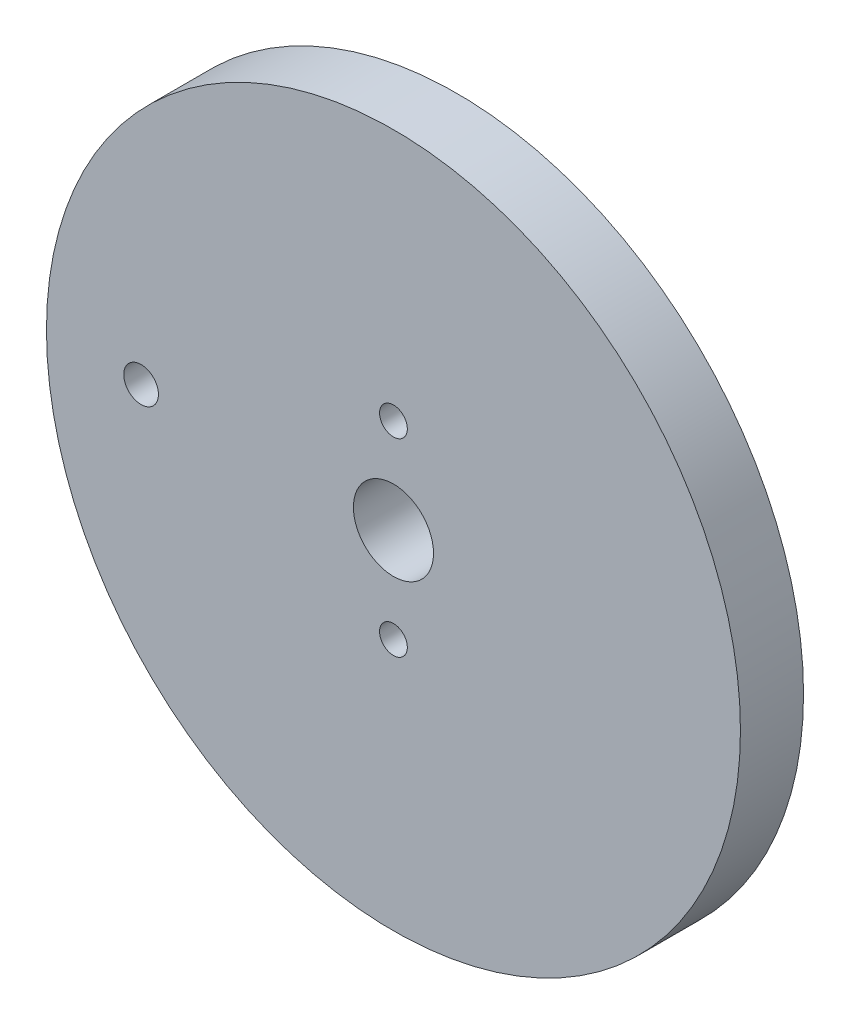
from build123d import *

# Parameters (mm, degrees)
SKETCH1_R          = 55
EXTRUDE_3_8_DEPTH  = 10
SKETCH5_R          = 6.35
CUT_EXTRUDE2_DEPTH = 10
SKETCH6_R          = 2.2
M4_THROUGH2_DEPTH  = 10
SKETCH7_R          = 2.75
CUT_EXTRUDE4_DEPTH = 10


with BuildPart() as part:
    # Sketch1 → 3/8 (new body)
    with BuildSketch(Plane.XY):
        Circle(SKETCH1_R)
    extrude(amount=EXTRUDE_3_8_DEPTH)

    # Sketch5 → Cut-Extrude2 (cut)
    with BuildSketch(Plane.XY.offset(10)):
        Circle(SKETCH5_R)
    extrude(amount=-CUT_EXTRUDE2_DEPTH, mode=Mode.SUBTRACT)

    # Sketch6 → M4_through2 (cut)
    with BuildSketch(Plane.XY.offset(10)):
        with Locations((0, 15)):
            Circle(SKETCH6_R)
        with Locations((0, -15)):
            Circle(SKETCH6_R)
    extrude(amount=-M4_THROUGH2_DEPTH, mode=Mode.SUBTRACT)

    # Sketch7 → Cut-Extrude4 (cut)
    with BuildSketch(Plane.XY.offset(10)):
        with Locations((-40, 0)):
            Circle(SKETCH7_R)
    extrude(amount=-CUT_EXTRUDE4_DEPTH, mode=Mode.SUBTRACT)


solid = part.part
